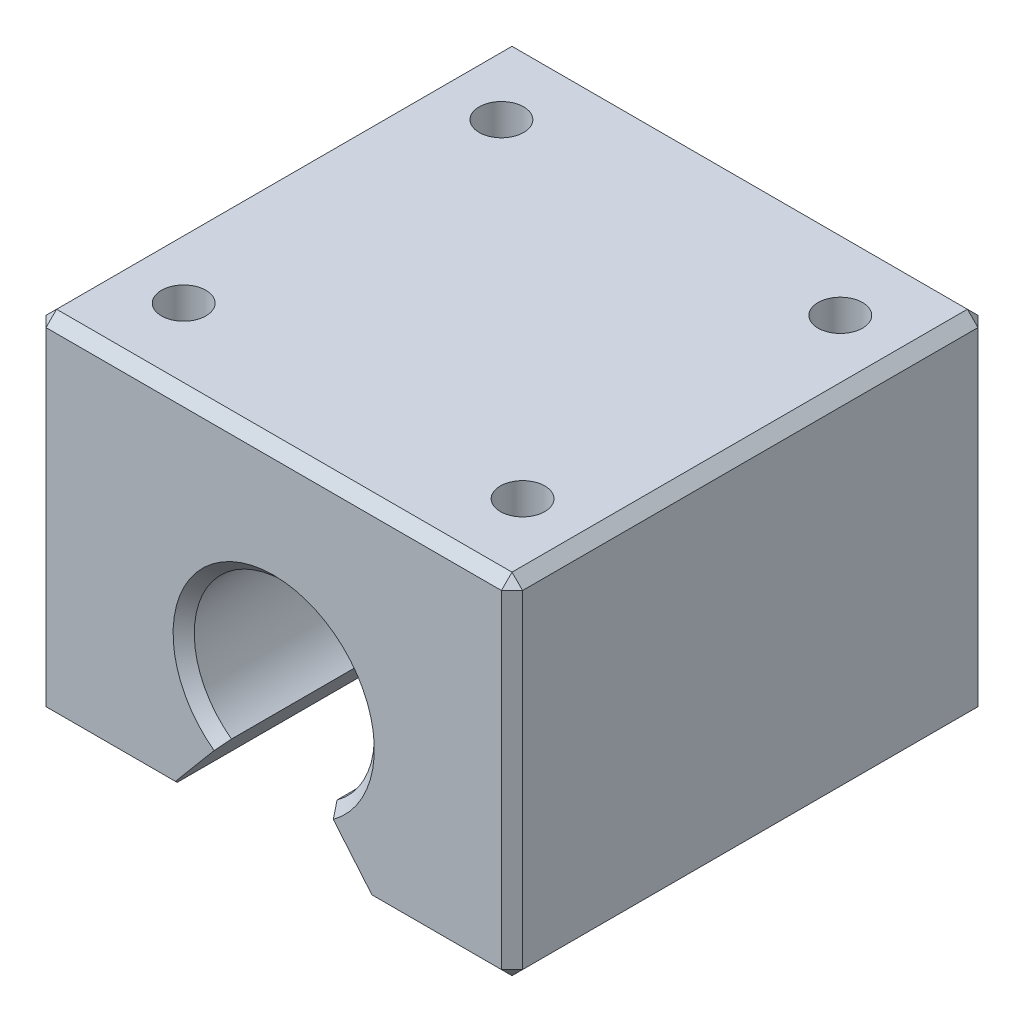
from build123d import *

# Parameters (mm, degrees)
SKETCH1_W             = 45
SKETCH1_H             = 33
EXTRUDE1_DEPTH        = 45
EXTRUDE3_DEPTH        = 53.948087784
M5_TAPPED_HOLE1_D     = 4.2
M5_TAPPED_HOLE1_DEPTH = 10
M5_TAPPED_HOLE1_TIP   = 1.2618073
CHAMFER1_SIZE         = 1


with BuildPart() as part:
    # Sketch1 → Extrude1 (new body)
    with BuildSketch(Plane.XY):
        Rectangle(SKETCH1_W, SKETCH1_H)
    extrude(amount=EXTRUDE1_DEPTH)

    # Sketch2 → Extrude3 (cut, through all)
    with BuildSketch(Plane.XY.offset(45)):
        with BuildLine():
            Line((4.983173546, -10.386071552), (0, -4.447356576))
            Line((0, -4.447356576), (-4.983173546, -10.386071552))
            ThreePointArc((-4.983173546, -10.386071552), (0, -12), (4.983173546, -10.386071552))
        make_face()
        with BuildLine():
            Line((-4.983173546, -10.386071552), (0, -4.447356576))
            Line((0, -4.447356576), (4.983173546, -10.386071552))
            ThreePointArc((4.983173546, -10.386071552), (7.569906708, -7.366071964), (8.5, -3.5))
            ThreePointArc((8.5, -3.5), (-3.866071964, 4.069906708), (-4.983173546, -10.386071552))
        make_face()
        Polygon((10.113368652, -16.5), (-10.113368652, -16.5), (-13.53955506, -20.583169961), (13.53955506, -20.583169961), align=None)
        with BuildLine():
            ThreePointArc((4.983173546, -10.386071552), (0, -12), (-4.983173546, -10.386071552))
            Line((-4.983173546, -10.386071552), (-10.113368652, -16.5))
            Line((-10.113368652, -16.5), (10.113368652, -16.5))
            Line((10.113368652, -16.5), (4.983173546, -10.386071552))
        make_face()
    extrude(amount=-EXTRUDE3_DEPTH, mode=Mode.SUBTRACT)

    # M5 Tapped Hole1
    with Locations(Plane(origin=(0, 16.5, 0), x_dir=(-1, 0, 0), z_dir=(0, 1, 0))):
        with Locations((16, 7.5), (-16, 7.5), (-16, 37.5), (16, 37.5)):
            Hole(M5_TAPPED_HOLE1_D / 2, depth=M5_TAPPED_HOLE1_DEPTH)
            with Locations((0, 0, -(M5_TAPPED_HOLE1_DEPTH + M5_TAPPED_HOLE1_TIP / 2))):  # 118° drill point
                Cone(0, M5_TAPPED_HOLE1_D / 2, M5_TAPPED_HOLE1_TIP, mode=Mode.SUBTRACT)

    # Chamfer1
    chamfer1_edges = [part.edges().sort_by_distance(p)[0] for p in [
        (-22.5, 0, 45),
        (-16.306684326, -16.5, 45),
        (16.306684326, -16.5, 0),
        (16.306684326, -16.5, 45),
        (0, 5, 45),
        (0, 5, 0),
        (22.5, 0, 45),
        (-16.306684326, -16.5, 0),
        (-22.5, 0, 0),
        (0, 16.5, 0),
        (22.5, 0, 0),
        (0, 16.5, 45),
        (22.5, -16.5, 22.5),
        (-22.5, -16.5, 22.5),
        (-22.5, 16.5, 22.5),
        (22.5, 16.5, 22.5),
    ]]
    chamfer(chamfer1_edges, length=CHAMFER1_SIZE)


solid = part.part
